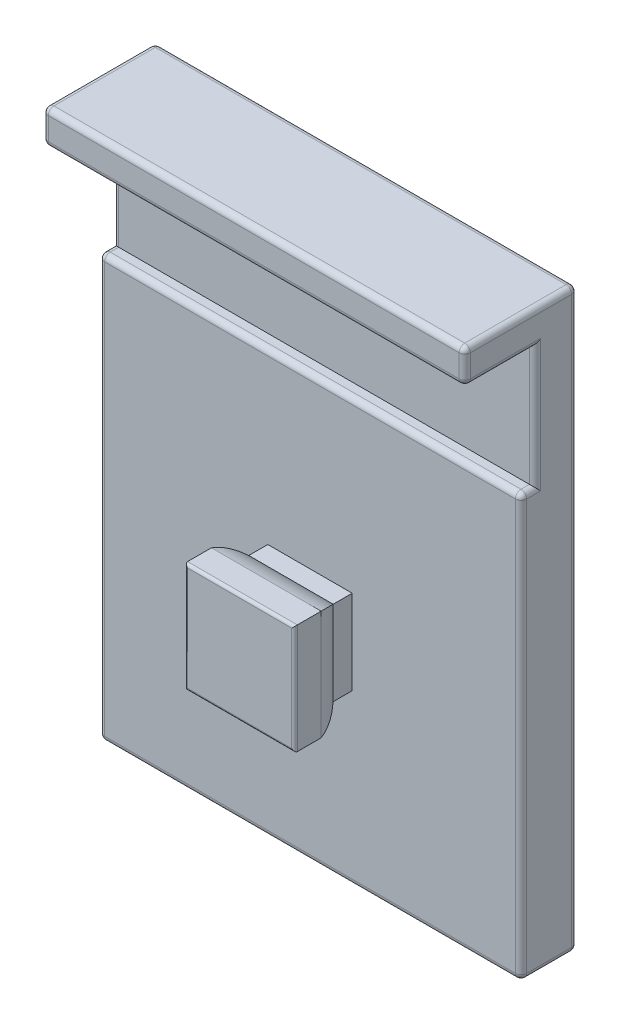
from build123d import *

# Parameters (mm, degrees)
SKETCH_1_W                      = 15
SKETCH_1_H                      = 15
EXTRUDE_1_DEPTH                 = 2
SKETCH_2_W                      = 3
SKETCH_2_H                      = 3
EXTRUDE_2_DEPTH                 = 1
EXTRUDE_3_DEPTH                 = 2
EXTRUDE_3_DEPTH_BACK            = 2
CUT_EXTRUDE_1_REACH             = 12.897
CUT_EXTRUDE_1_DIRECTION_2_REACH = 12.897
FILLET_1_R                      = 0.1
SKETCH_5_W                      = 15
SKETCH_5_H                      = 1.5
EXTRUDE_4_DEPTH                 = 5.5
SKETCH_6_W                      = 15
SKETCH_6_H                      = 1.2
EXTRUDE_5_DEPTH                 = 2.5
FILLET_2_R                      = 0.2


with BuildPart() as part:
    # 草图1 → 凸台-拉伸1 (new body)
    with BuildSketch(Plane.XY):
        Rectangle(SKETCH_1_W, SKETCH_1_H)
    extrude(amount=-EXTRUDE_1_DEPTH)

    # 草图2 → 凸台-拉伸2 (add)
    with BuildSketch(Plane.XY):
        Rectangle(SKETCH_2_W, SKETCH_2_H)
    extrude(amount=EXTRUDE_2_DEPTH)

    # 草图3 → 凸台-拉伸3 (add, two sides: drawn at the far end of the back side and taken through both)
    with BuildSketch(Plane(origin=(0, 0, 0), x_dir=(1, 0, 0), z_dir=(0, 1, 0)).offset(-EXTRUDE_3_DEPTH_BACK)):
        with BuildLine():
            Line((-1.95, -2.5), (1.95, -2.5))
            Line((1.95, -2.5), (1.95, -1.555590279))
            ThreePointArc((1.95, -1.555590279), (1.780042303, -1.088161527), (1.5, -0.677124344))
            Line((1.5, -0.677124344), (-1.5, -0.677124344))
            ThreePointArc((-1.5, -0.677124344), (-1.780042303, -1.088161527), (-1.95, -1.555590279))
            Line((-1.95, -1.555590279), (-1.95, -2.5))
        make_face()
    extrude(amount=EXTRUDE_3_DEPTH + EXTRUDE_3_DEPTH_BACK)

    # 草图4 → 切除-拉伸1 (cut, up to next)
    with BuildSketch(Plane(origin=(0, 0, 0), x_dir=(0, 0, -1), z_dir=(1, 0, 0)), mode=Mode.PRIVATE) as cut_extrude_1_sk1:
        with BuildLine():
            Line((-2.5, 1.95), (-1.555590279, 1.95))
            ThreePointArc((-1.555590279, 1.95), (-1.088161527, 1.780042303), (-0.677124344, 1.5))
            Line((-0.677124344, 1.5), (-0.677124344, 2))
            Line((-0.677124344, 2), (-2.5, 2))
            Line((-2.5, 2), (-2.5, 1.95))
        make_face()
    cut_extrude_1_tool1 = extrude(cut_extrude_1_sk1.sketch, amount=-CUT_EXTRUDE_1_REACH, mode=Mode.PRIVATE) & part.part
    # 草图4 → 切除-拉伸1 (cut, up to next)
    with BuildSketch(Plane(origin=(0, 0, 0), x_dir=(0, 0, -1), z_dir=(1, 0, 0)), mode=Mode.PRIVATE) as cut_extrude_1_sk2:
        with BuildLine():
            Line((-2.5, -2), (-0.677124344, -2))
            Line((-0.677124344, -2), (-0.677124344, -1.5))
            ThreePointArc((-0.677124344, -1.5), (-1.088161527, -1.780042303), (-1.555590279, -1.95))
            Line((-1.555590279, -1.95), (-2.5, -1.95))
            Line((-2.5, -1.95), (-2.5, -2))
        make_face()
    cut_extrude_1_tool2 = extrude(cut_extrude_1_sk2.sketch, amount=-CUT_EXTRUDE_1_REACH, mode=Mode.PRIVATE) & part.part
    add(cut_extrude_1_tool1.solids().sort_by_distance((0, 1.873038, 1.175075))[0], mode=Mode.SUBTRACT)
    add(cut_extrude_1_tool2.solids().sort_by_distance((0, -1.873038, 1.175075))[0], mode=Mode.SUBTRACT)

    # 草图4 → 切除-拉伸1 direction 2 (cut, up to next)
    with BuildSketch(Plane(origin=(0, 0, 0), x_dir=(0, 0, -1), z_dir=(1, 0, 0)), mode=Mode.PRIVATE) as cut_extrude_1_direction_2_sk1:
        with BuildLine():
            Line((-2.5, 1.95), (-1.555590279, 1.95))
            ThreePointArc((-1.555590279, 1.95), (-1.088161527, 1.780042303), (-0.677124344, 1.5))
            Line((-0.677124344, 1.5), (-0.677124344, 2))
            Line((-0.677124344, 2), (-2.5, 2))
            Line((-2.5, 2), (-2.5, 1.95))
        make_face()
    cut_extrude_1_direction_2_tool1 = extrude(cut_extrude_1_direction_2_sk1.sketch, amount=CUT_EXTRUDE_1_DIRECTION_2_REACH, mode=Mode.PRIVATE) & part.part
    # 草图4 → 切除-拉伸1 direction 2 (cut, up to next)
    with BuildSketch(Plane(origin=(0, 0, 0), x_dir=(0, 0, -1), z_dir=(1, 0, 0)), mode=Mode.PRIVATE) as cut_extrude_1_direction_2_sk2:
        with BuildLine():
            Line((-2.5, -2), (-0.677124344, -2))
            Line((-0.677124344, -2), (-0.677124344, -1.5))
            ThreePointArc((-0.677124344, -1.5), (-1.088161527, -1.780042303), (-1.555590279, -1.95))
            Line((-1.555590279, -1.95), (-2.5, -1.95))
            Line((-2.5, -1.95), (-2.5, -2))
        make_face()
    cut_extrude_1_direction_2_tool2 = extrude(cut_extrude_1_direction_2_sk2.sketch, amount=CUT_EXTRUDE_1_DIRECTION_2_REACH, mode=Mode.PRIVATE) & part.part
    add(cut_extrude_1_direction_2_tool1.solids().sort_by_distance((0, 1.873038, 1.175075))[0], mode=Mode.SUBTRACT)
    add(cut_extrude_1_direction_2_tool2.solids().sort_by_distance((0, -1.873038, 1.175075))[0], mode=Mode.SUBTRACT)

    # 圆角1
    fillet_1_edges = [part.edges().sort_by_distance(p)[0] for p in [
        (-1.95, 0, 2.5),
        (1.95, 0, 2.5),
        (0, -1.95, 2.5),
        (0, 1.95, 2.5),
    ]]
    fillet(fillet_1_edges, radius=FILLET_1_R)

    # 草图5 → 凸台-拉伸4 (add)
    with BuildSketch(Plane(origin=(0, 7.5, 0), x_dir=(1, 0, 0), z_dir=(0, 1, 0))):
        with Locations((0, 1.25)):
            Rectangle(SKETCH_5_W, SKETCH_5_H)
    extrude(amount=EXTRUDE_4_DEPTH)

    # 草图6 → 凸台-拉伸5 (add)
    with BuildSketch(Plane.XY.offset(-0.5)):
        with Locations((0, 12.4)):
            Rectangle(SKETCH_6_W, SKETCH_6_H)
    extrude(amount=EXTRUDE_5_DEPTH)

    # 圆角2
    fillet_2_edges = [part.edges().sort_by_distance(p)[0] for p in [
        (0, -7.5, -2),
        (0, -7.5, 0),
        (-7.5, -7.5, -1),
        (-7.5, 2.75, -2),
        (-7.5, 12.4, 2),
        (-7.5, 11.8, 0.75),
        (-7.5, 9.65, -0.5),
        (-7.5, 7.5, -0.25),
        (-7.5, 0, 0),
        (7.5, 7.5, -0.25),
        (7.5, 9.65, -0.5),
        (7.5, 11.8, 0.75),
        (7.5, 12.4, 2),
        (7.5, 2.75, -2),
        (7.5, -7.5, -1),
        (7.5, 0, 0),
        (0, 13, -2),
        (7.5, 13, 0),
        (0, 13, 2),
        (-7.5, 13, 0),
        (0, 7.5, 0),
        (0, 11.8, 2),
    ]]
    fillet(fillet_2_edges, radius=FILLET_2_R)


solid = part.part
